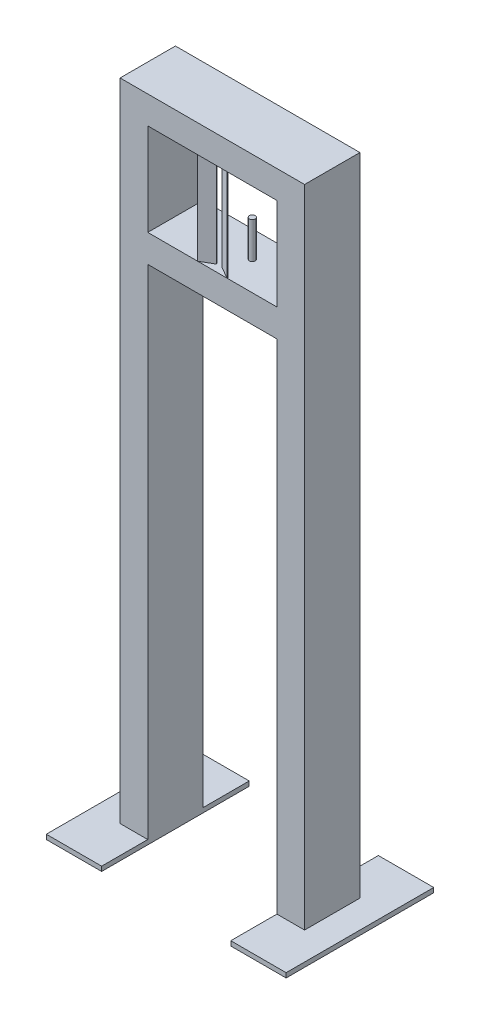
from build123d import *

# Parameters (mm, degrees)
SKETCH1_W             = 76.2
SKETCH1_H             = 203.2
BOSS_EXTRUDE1_DEPTH   = 6.35
BOSS_EXTRUDE1_2_DEPTH = 6.35
SKETCH2_W             = 38.1
SKETCH2_H             = 76.2
BOSS_EXTRUDE2_DEPTH   = 889
SKETCH3_W             = 177.8
SKETCH3_H             = 38.1
BOSS_EXTRUDE3_DEPTH   = 76.2
BOSS_EXTRUDE4_REACH   = 777.766
SKETCH7_R             = 4
BOSS_EXTRUDE5_DEPTH   = 50


with BuildPart() as part:
    # Sketch1 → Boss-Extrude1 (new body)
    with BuildSketch(Plane(origin=(0, 0, 0), x_dir=(1, 0, 0), z_dir=(0, 1, 0))):
        with Locations((127, -101.6)):
            Rectangle(SKETCH1_W, SKETCH1_H)
    extrude(amount=BOSS_EXTRUDE1_DEPTH)



with BuildPart() as body_2:
    # Sketch1 → Boss-Extrude1 2 (new body)
    with BuildSketch(Plane(origin=(0, 0, 0), x_dir=(1, 0, 0), z_dir=(0, 1, 0))):
        with Locations((-127, -101.6)):
            Rectangle(SKETCH1_W, SKETCH1_H)
    extrude(amount=BOSS_EXTRUDE1_2_DEPTH)


with BuildPart() as part_1:
    add(part.part)

    add(body_2.part)  # Boss-Extrude2 merges body 2
    # Sketch2 → Boss-Extrude2 (add)
    with BuildSketch(Plane(origin=(0, 6.35, 0), x_dir=(1, 0, 0), z_dir=(0, 1, 0))):
        with Locations((-107.95, -101.6)):
            Rectangle(SKETCH2_W, SKETCH2_H)
        with Locations((107.95, -101.6)):
            Rectangle(SKETCH2_W, SKETCH2_H)
    extrude(amount=BOSS_EXTRUDE2_DEPTH)

    # Sketch3 → Boss-Extrude3 (add)
    with BuildSketch(Plane.XY.offset(139.7)):
        with Locations((0, 876.3)):
            Rectangle(SKETCH3_W, SKETCH3_H)
        with Locations((0, 711.2)):
            Rectangle(SKETCH3_W, SKETCH3_H)
    extrude(amount=-BOSS_EXTRUDE3_DEPTH)

    # Sketch6 → Boss-Extrude4 (add, up to next)
    with BuildSketch(Plane(origin=(0, 730.25, 0), x_dir=(1, 0, 0), z_dir=(0, 1, 0)), mode=Mode.PRIVATE) as boss_extrude4_sk1:
        Polygon((-3.75, -130.2), (-20.204482672, -139.7), (-20.829482672, -138.617468245), (-4.375, -129.117468245), align=None)
    boss_extrude4_tool1 = extrude(boss_extrude4_sk1.sketch, amount=BOSS_EXTRUDE4_REACH, mode=Mode.PRIVATE) - part_1.part
    # Sketch6 → Boss-Extrude4 (add, up to next)
    with BuildSketch(Plane(origin=(0, 730.25, 0), x_dir=(1, 0, 0), z_dir=(0, 1, 0)), mode=Mode.PRIVATE) as boss_extrude4_sk2:
        Polygon((20.829482672, -138.617468245), (20.204482672, -139.7), (3.75, -130.2), (4.375, -129.117468245), align=None)
    boss_extrude4_tool2 = extrude(boss_extrude4_sk2.sketch, amount=BOSS_EXTRUDE4_REACH, mode=Mode.PRIVATE) - part_1.part
    add(boss_extrude4_tool1.solids().sort_by_distance((-12.289741, 730.25, 134.408734))[0])
    add(boss_extrude4_tool2.solids().sort_by_distance((12.289741, 730.25, 134.408734))[0])

    # Sketch7 → Boss-Extrude5 (add)
    with BuildSketch(Plane(origin=(0, 730.25, 0), x_dir=(1, 0, 0), z_dir=(0, 1, 0))):
        with Locations(Location((15, -99.7, 0), (0, 0, 270))):
            Circle(SKETCH7_R)
    extrude(amount=BOSS_EXTRUDE5_DEPTH)


solid = part_1.part
